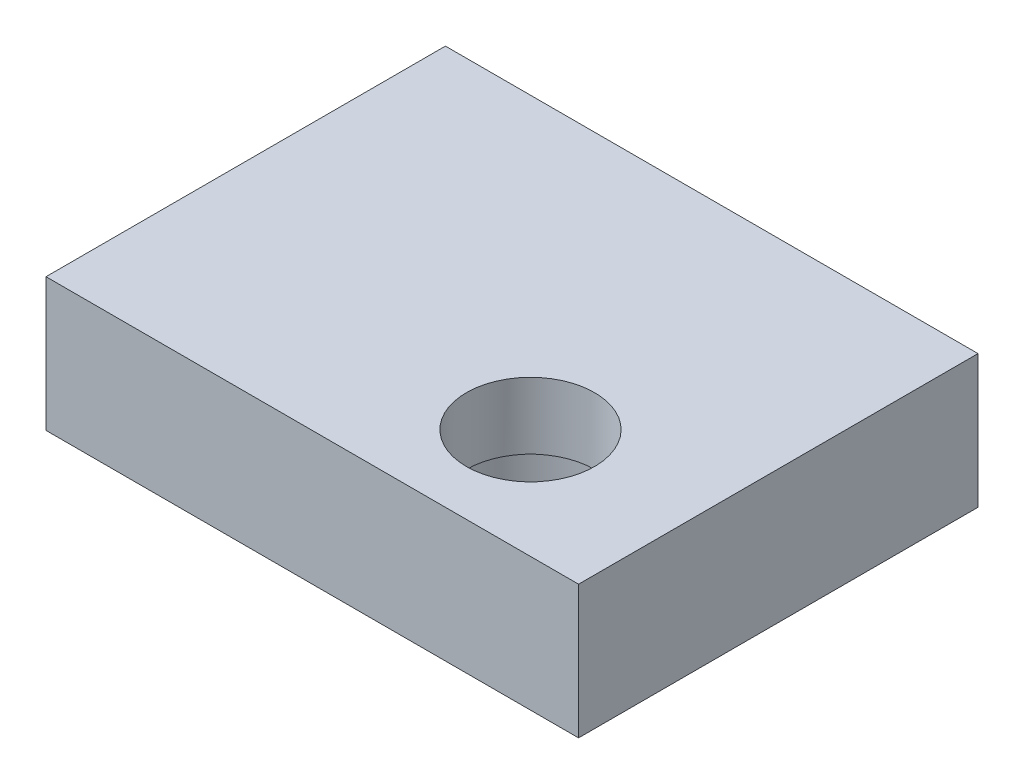
from build123d import *

# Parameters (mm, degrees)
SKETCH1_W           = 40
SKETCH1_H           = 30
BOSS_EXTRUDE1_DEPTH = 10
SKETCH2_R           = 2
SKETCH2_R_2         = 6.25
CUT_EXTRUDE1_DEPTH  = 5
SKETCH3_R           = 4.8125
CUT_EXTRUDE2_DEPTH  = 10


with BuildPart() as part:
    # Sketch1 → Boss-Extrude1 (new body)
    with BuildSketch(Plane(origin=(0, 0, 0), x_dir=(1, 0, 0), z_dir=(0, 1, 0))):
        Rectangle(SKETCH1_W, SKETCH1_H)
    extrude(amount=BOSS_EXTRUDE1_DEPTH)

    # Sketch2 → Cut-Extrude1 (cut)
    with BuildSketch(Plane(origin=(0, 0, 0), x_dir=(-1, 0, 0), z_dir=(0, -1, 0))):
        with Locations(Location((13.333333333, -10, 0), (0, 0, 90))):
            Circle(SKETCH2_R)
        with Locations(Location((13.333333333, 10, 0), (0, 0, 270))):
            Circle(SKETCH2_R)
        with Locations(Location((-13.333333333, 10, 0), (0, 0, 90))):
            Circle(SKETCH2_R)
        with Locations(Location((-8.14, -6.75, 0), (0, 0, 90))):
            Circle(SKETCH2_R_2)
    extrude(amount=-CUT_EXTRUDE1_DEPTH, mode=Mode.SUBTRACT)

    # Sketch3 → Cut-Extrude2 (cut)
    with BuildSketch(Plane(origin=(0, 10, 0), x_dir=(1, 0, 0), z_dir=(0, 1, 0))):
        with Locations(Location((8.14, -6.75, 0), (0, 0, 270))):
            Circle(SKETCH3_R)
    extrude(amount=-CUT_EXTRUDE2_DEPTH, mode=Mode.SUBTRACT)


solid = part.part
